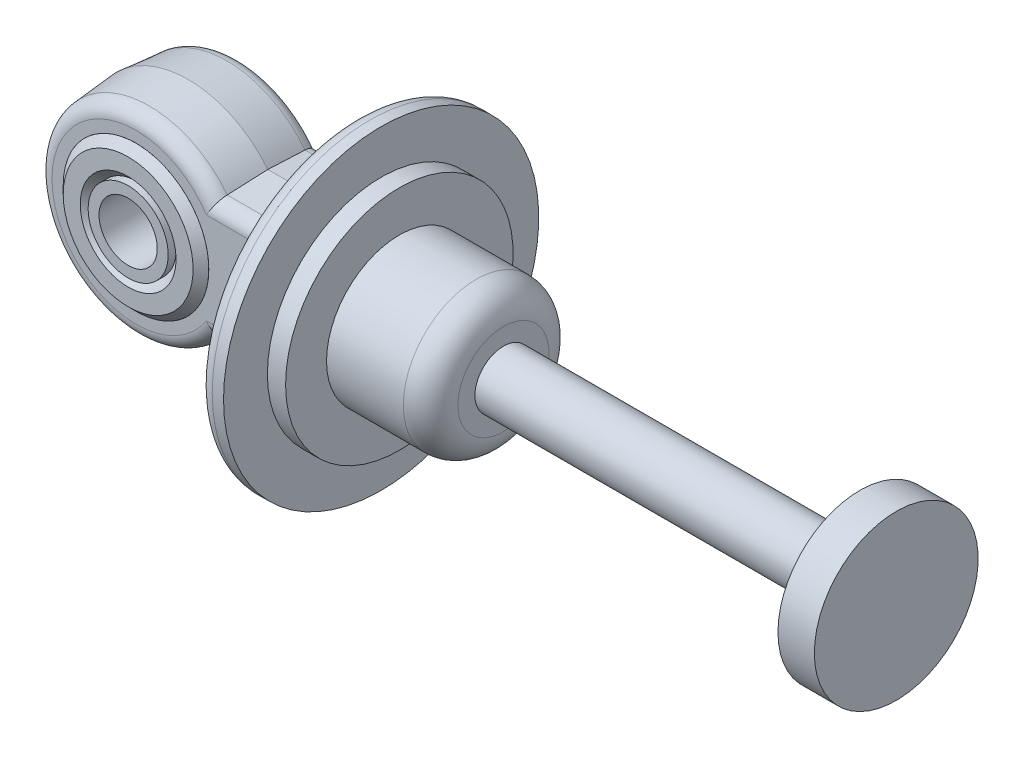
from build123d import *

# Parameters (mm, degrees)
FILLET1_R                     = 2.54
BOSS_EXTRUDE1_DEPTH           = 9.1059
BOSS_EXTRUDE1_DRAFT           = 5
BOSS_EXTRUDE1_OTHER_WAY_DEPTH = 9.1059
BOSS_EXTRUDE1_OTHER_WAY_DRAFT = -5
FILLET2_R                     = 2.54
FILLET3_R                     = 1.27
CUT_EXTRUDE1_DEPTH            = 138.390424054
CUT_EXTRUDE1_DEPTH_BACK       = 138.390424054
SKETCH3_R                     = 12.7
SKETCH5_W                     = 1.905
SKETCH5_H                     = 20.955


with BuildPart() as part:
    # Sketch1 → Revolve1 (revolve)
    with BuildSketch(Plane.XY, mode=Mode.PRIVATE) as revolve1_sk:
        with BuildLine():
            Line((3.175, 4.9784), (-77.163, 4.9784))
            Line((-77.163, 4.9784), (-77.163, 19.84375))
            Line((-77.163, 19.84375), (-80.338, 19.84375))
            Line((-80.338, 19.84375), (-80.338, 27.4955))
            Line((-80.338, 27.4955), (-84.148, 27.4955))
            ThreePointArc((-84.148, 27.4955), (-87.569206497, 13.936514129), (-88.72, 0))
            Line((-88.72, 0), (0, 0))
            Line((0, 0), (9.525, 0))
            Line((9.525, 0), (9.525, 14.2875))
            Line((9.525, 14.2875), (3.175, 14.2875))
            Line((3.175, 14.2875), (3.175, 4.9784))
        make_face()
    revolve(revolve1_sk.sketch.rotate(Axis((0, 0, 0), (1, 0, 0)), 90), axis=Axis((0, 0, 0), (1, 0, 0)))

    # Fillet1
    fillet1_edges = [part.edges().sort_by_distance(p)[0] for p in [
        (-84.148, 0, -27.4955),
    ]]
    fillet(fillet1_edges, radius=FILLET1_R)


with BuildPart() as boss_extrude1_tool:
    # Sketch2 → Boss-Extrude1 (with draft: the straight prism first)
    with BuildSketch(Plane.XY):
        with BuildLine():
            Line((-80.338, 11.1125), (-100.113491949, 11.1125))
            ThreePointArc((-100.113491949, 11.1125), (-131.773, 0), (-100.113491949, -11.1125))
            Line((-100.113491949, -11.1125), (-80.338, -11.1125))
            Line((-80.338, -11.1125), (-80.338, 11.1125))
        make_face()
    extrude(amount=BOSS_EXTRUDE1_DEPTH)
    # Boss-Extrude1: the draft: its side faces are tilted about the plane it starts from
    boss_extrude1_sides = [boss_extrude1_tool.faces().sort_by_distance(p)[0] for p in [
        (-90.225745974, -11.1125, 4.55295),
        (-80.338, 0, 4.55295),
        (-90.225745974, 11.1125, 4.55295),
        (-131.773, 0, 4.55295),
    ]]
    draft(boss_extrude1_sides, Plane.XY, BOSS_EXTRUDE1_DRAFT)


with BuildPart() as part_1:
    add(part.part)

    # Boss-Extrude1: add boss_extrude1_tool
    add(boss_extrude1_tool.part)


with BuildPart() as boss_extrude1_other_way_tool:
    # Sketch2 → Boss-Extrude1 other way (with draft: the straight prism first)
    with BuildSketch(Plane.XY):
        with BuildLine():
            Line((-80.338, 11.1125), (-100.113491949, 11.1125))
            ThreePointArc((-100.113491949, 11.1125), (-131.773, 0), (-100.113491949, -11.1125))
            Line((-100.113491949, -11.1125), (-80.338, -11.1125))
            Line((-80.338, -11.1125), (-80.338, 11.1125))
        make_face()
    extrude(amount=-BOSS_EXTRUDE1_OTHER_WAY_DEPTH)
    # Boss-Extrude1 other way: the draft: its side faces are tilted about the plane it starts from
    boss_extrude1_other_way_sides = [boss_extrude1_other_way_tool.faces().sort_by_distance(p)[0] for p in [
        (-90.225745974, -11.1125, -4.55295),
        (-80.338, 0, -4.55295),
        (-90.225745974, 11.1125, -4.55295),
        (-131.773, 0, -4.55295),
    ]]
    draft(boss_extrude1_other_way_sides, Plane.XY, BOSS_EXTRUDE1_OTHER_WAY_DRAFT)


with BuildPart() as part_2:
    add(part_1.part)

    # Boss-Extrude1 other way: add boss_extrude1_other_way_tool
    add(boss_extrude1_other_way_tool.part)

    # Fillet2
    fillet2_edges = [part_2.edges().sort_by_distance(p)[0] for p in [
        (-94.050006029, -10.315836979, -9.1059),
        (-130.976336979, 0, -9.1059),
        (-94.050006029, 10.315836979, -9.1059),
        (-94.050006029, -10.315836979, 9.1059),
        (-130.976336979, 0, 9.1059),
        (-94.050006029, 10.315836979, 9.1059),
    ]]
    fillet(fillet2_edges, radius=FILLET2_R)

    # Fillet3
    fillet3_edges = [part_2.edges().sort_by_distance(p)[0] for p in [
        (-87.960375334, -10.815421054, 3.395627894),
        (-87.960375334, -10.815421054, -3.395627894),
        (-88.230631305, -6e-09, -9.1059),
        (-87.960375334, 10.815421054, -3.395627894),
        (-88.135938042, 3.998660296, 9.1059),
        (-87.960375334, 10.815421054, 3.395627894),
        (-87.741114978, -9.703456503, -8.439407303),
        (-87.741114978, 9.703456503, -8.439407303),
        (-87.741114978, -9.703456503, 8.439407303),
        (-87.741114978, 9.703456503, 8.439407303),
    ]]
    fillet(fillet3_edges, radius=FILLET3_R)

    # Sketch3 → Cut-Extrude1 (cut, two sides: drawn at the far end of the back side and taken through both)
    with BuildSketch(Plane.XY.offset(-CUT_EXTRUDE1_DEPTH_BACK)):
        with Locations((-113.993, 0)):
            Circle(SKETCH3_R)
    extrude(amount=CUT_EXTRUDE1_DEPTH + CUT_EXTRUDE1_DEPTH_BACK, mode=Mode.SUBTRACT)


with BuildPart() as body_2:
    # Sketch4 → Revolve2 (revolve)
    with BuildSketch(Plane(origin=(0, 0, 0), x_dir=(1, 0, 0), z_dir=(0, 1, 0)), mode=Mode.PRIVATE) as revolve2_sk:
        Polygon((-101.293, 9.1059), (-102.6646, 10.4775), (-105.6364, 10.4775), (-107.008, 9.1059), (-107.008, -9.1059), (-105.6364, -10.4775), (-102.6646, -10.4775), (-101.293, -9.1059), align=None)
    revolve(revolve2_sk.sketch.rotate(Axis((-113.993, 0, -15.28195421), (0, 0, 1)), 180), axis=Axis((-113.993, 0, -15.28195421), (0, 0, 1)))


with BuildPart() as body_3:
    # Sketch5 → Revolve3 (revolve)
    with BuildSketch(Plane(origin=(0, 0, 0), x_dir=(1, 0, 0), z_dir=(0, 1, 0)), mode=Mode.PRIVATE) as revolve3_sk:
        with Locations((-107.9605, 0)):
            Rectangle(SKETCH5_W, SKETCH5_H)
    revolve(revolve3_sk.sketch.rotate(Axis((-113.993, 0, -15.28195421), (0, 0, 1)), 180), axis=Axis((-113.993, 0, -15.28195421), (0, 0, 1)))


with BuildPart() as body_4:
    # Sketch7 → Revolve4 (revolve)
    with BuildSketch(Plane.XY, mode=Mode.PRIVATE) as revolve4_sk:
        with BuildLine():
            Line((-77.163, 12.7), (-63.7645, 12.7))
            ThreePointArc((-63.7645, 12.7), (-60.396903955, 11.305096045), (-59.002, 7.9375))
            Line((-59.002, 7.9375), (-59.002, 4.9784))
            Line((-59.002, 4.9784), (-77.163, 4.9784))
            Line((-77.163, 4.9784), (-77.163, 12.7))
        make_face()
    revolve(revolve4_sk.sketch.rotate(Axis((0, 0, 0), (1, 0, 0)), 90), axis=Axis((0, 0, 0), (1, 0, 0)))


solid = Compound([part_2.part, body_2.part, body_3.part, body_4.part])
